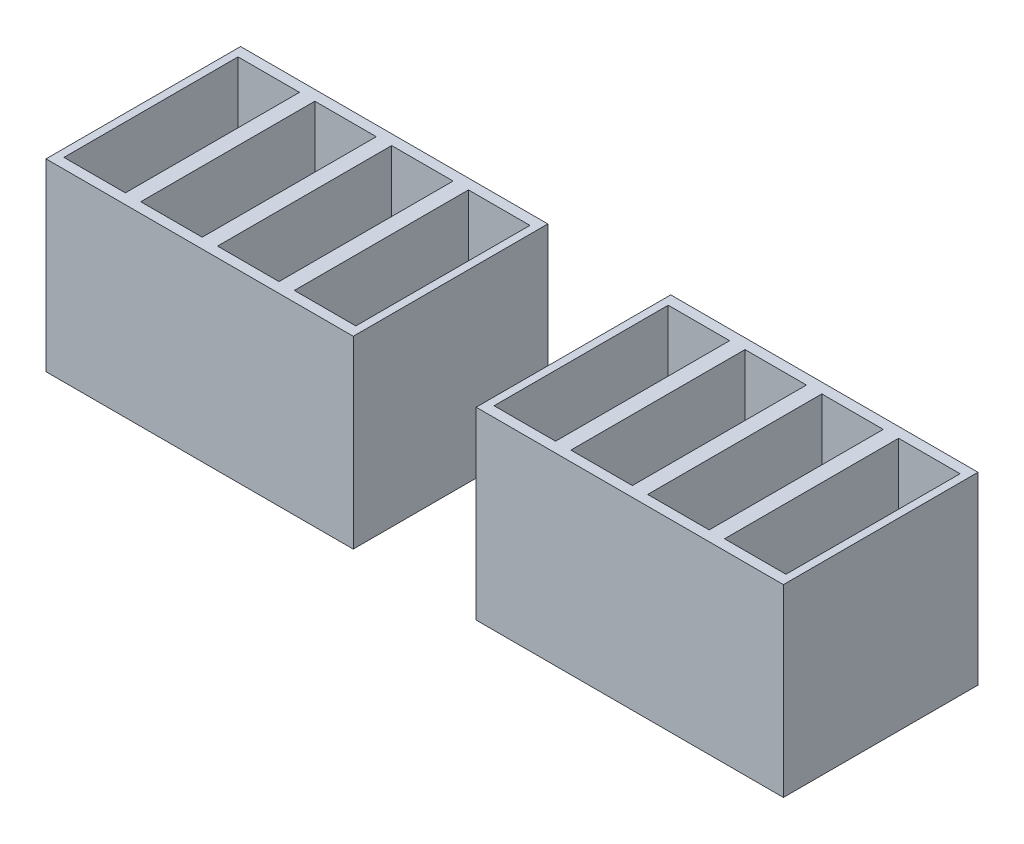
from build123d import *

# Parameters (mm, degrees)
SKETCH1_W             = 1524
SKETCH1_H             = 965.2
SKETCH1_W_2           = 304.8
SKETCH1_H_2           = 863.6
BOSS_EXTRUDE2_DEPTH   = 914.4
BOSS_EXTRUDE2_2_DEPTH = 914.4


with BuildPart() as part:
    # Sketch1 → Boss-Extrude2 (new body)
    with BuildSketch(Plane(origin=(0, 0, 0), x_dir=(1, 0, 0), z_dir=(0, 1, 0))):
        with Locations((-1066.8, 0)):
            Rectangle(SKETCH1_W, SKETCH1_H)
        with Locations((-1638.3, 0)):
            Rectangle(SKETCH1_W_2, SKETCH1_H_2, mode=Mode.SUBTRACT)
        with Locations((-1257.3, 0)):
            Rectangle(SKETCH1_W_2, SKETCH1_H_2, mode=Mode.SUBTRACT)
        with Locations((-876.3, 0)):
            Rectangle(SKETCH1_W_2, SKETCH1_H_2, mode=Mode.SUBTRACT)
        with Locations((-495.3, 0)):
            Rectangle(SKETCH1_W_2, SKETCH1_H_2, mode=Mode.SUBTRACT)
    extrude(amount=BOSS_EXTRUDE2_DEPTH)


with BuildPart() as body_2:
    # Sketch1 → Boss-Extrude2 2 (new body)
    with BuildSketch(Plane(origin=(0, 0, 0), x_dir=(1, 0, 0), z_dir=(0, 1, 0))):
        with Locations((1066.8, 0)):
            Rectangle(SKETCH1_W, SKETCH1_H)
        with Locations((495.3, 0)):
            Rectangle(SKETCH1_W_2, SKETCH1_H_2, mode=Mode.SUBTRACT)
        with Locations((876.3, 0)):
            Rectangle(SKETCH1_W_2, SKETCH1_H_2, mode=Mode.SUBTRACT)
        with Locations((1257.3, 0)):
            Rectangle(SKETCH1_W_2, SKETCH1_H_2, mode=Mode.SUBTRACT)
        with Locations((1638.3, 0)):
            Rectangle(SKETCH1_W_2, SKETCH1_H_2, mode=Mode.SUBTRACT)
    extrude(amount=BOSS_EXTRUDE2_2_DEPTH)


solid = Compound([part.part, body_2.part])
